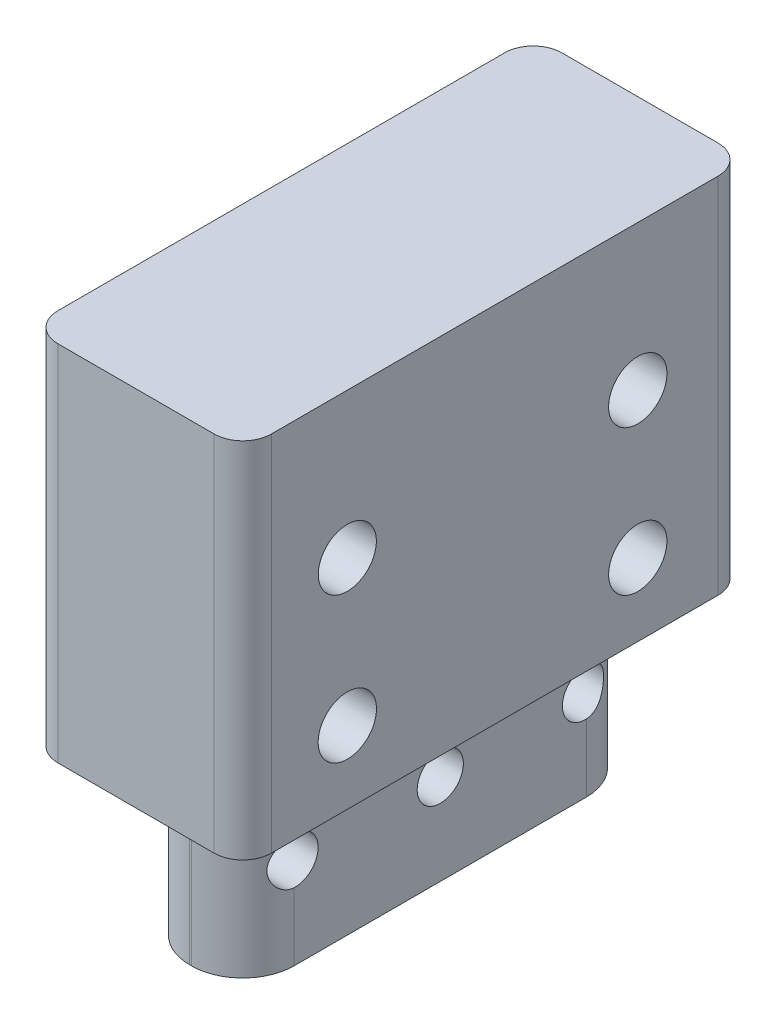
from build123d import *

# Parameters (mm, degrees)
SKETCH1_W           = 18.669
SKETCH1_H           = 50.8
BOSS_EXTRUDE1_DEPTH = 44.069
SKETCH2_W           = 44.069
SKETCH2_H           = 4.7625
CUT_EXTRUDE1_DEPTH  = 70.794328724
SKETCH3_W           = 44.069
SKETCH3_H           = 14.29004
CUT_EXTRUDE2_DEPTH  = 4.7625
SKETCH5_W           = 44.069
SKETCH5_H           = 14.29004
CUT_EXTRUDE3_DEPTH  = 4.7625
SKETCH4_W           = 18.669
SKETCH4_H           = 14.29004
CUT_EXTRUDE4_DEPTH  = 4.7625
SKETCH6_W           = 18.669
SKETCH6_H           = 14.29004
CUT_EXTRUDE5_DEPTH  = 4.7625
FILLET1_R           = 4.50088
FILLET2_R           = 2.49936
SKETCH7_R           = 2.5527
SKETCH7_R_2         = 2.54
CUT_EXTRUDE6_DEPTH  = 70.794328724
SKETCH8_R           = 2.0193
CUT_EXTRUDE7_DEPTH  = 69.673921566


with BuildPart() as part:
    # Sketch1 → Boss-Extrude1 (new body)
    with BuildSketch(Plane.XY):
        with Locations((9.3345, 25.4)):
            Rectangle(SKETCH1_W, SKETCH1_H)
    extrude(amount=BOSS_EXTRUDE1_DEPTH)

    # Sketch2 → Cut-Extrude1 (cut, through all)
    with BuildSketch(Plane(origin=(18.669, 0, 0), x_dir=(0, 0, -1), z_dir=(1, 0, 0))):
        with Locations((-22.0345, 2.38125)):
            Rectangle(SKETCH2_W, SKETCH2_H)
    extrude(amount=-CUT_EXTRUDE1_DEPTH, mode=Mode.SUBTRACT)

    # Sketch3 → Cut-Extrude2 (cut)
    with BuildSketch(Plane(origin=(18.669, 0, 0), x_dir=(0, 0, -1), z_dir=(1, 0, 0))):
        with Locations((-22.0345, 11.90752)):
            Rectangle(SKETCH3_W, SKETCH3_H)
    extrude(amount=-CUT_EXTRUDE2_DEPTH, mode=Mode.SUBTRACT)

    # Sketch5 → Cut-Extrude3 (cut)
    with BuildSketch(Plane.ZY):
        with Locations((22.0345, 11.90752)):
            Rectangle(SKETCH5_W, SKETCH5_H)
    extrude(amount=-CUT_EXTRUDE3_DEPTH, mode=Mode.SUBTRACT)

    # Sketch4 → Cut-Extrude4 (cut)
    with BuildSketch(Plane.XY.offset(44.069)):
        with Locations((9.3345, 11.90752)):
            Rectangle(SKETCH4_W, SKETCH4_H)
    extrude(amount=-CUT_EXTRUDE4_DEPTH, mode=Mode.SUBTRACT)

    # Sketch6 → Cut-Extrude5 (cut)
    with BuildSketch(Plane(origin=(0, 0, 0), x_dir=(-1, 0, 0), z_dir=(0, 0, -1))):
        with Locations((-9.3345, 11.90752)):
            Rectangle(SKETCH6_W, SKETCH6_H)
    extrude(amount=-CUT_EXTRUDE5_DEPTH, mode=Mode.SUBTRACT)

    # Fillet1
    fillet1_edges = [part.edges().sort_by_distance(p)[0] for p in [
        (4.7625, 11.90752, 39.3065),
        (13.9065, 11.90752, 39.3065),
        (4.7625, 11.90752, 4.7625),
        (13.9065, 11.90752, 4.7625),
    ]]
    fillet(fillet1_edges, radius=FILLET1_R)

    # Fillet2
    fillet2_edges = [part.edges().sort_by_distance(p)[0] for p in [
        (18.669, 34.92627, 0),
        (18.669, 34.92627, 44.069),
        (0, 34.92627, 44.069),
        (0, 34.92627, 0),
    ]]
    fillet(fillet2_edges, radius=FILLET2_R)

    # Sketch7 → Cut-Extrude6 (cut, through all)
    with BuildSketch(Plane.ZY):
        with Locations((9.52588, 38.1)):
            Circle(SKETCH7_R)
        with Locations((34.92588, 38.1)):
            Circle(SKETCH7_R_2)
        with Locations((34.92588, 25.4)):
            Circle(SKETCH7_R)
        with Locations((9.52588, 25.4)):
            Circle(SKETCH7_R)
    extrude(amount=-CUT_EXTRUDE6_DEPTH, mode=Mode.SUBTRACT)

    # Sketch8 → Cut-Extrude7 (cut, through all)
    with BuildSketch(Plane.ZY.offset(-4.7625)):
        with Locations((22.03538, 12.7)):
            Circle(SKETCH8_R)
        with Locations(Location((34.73538, 12.7, 0), (0, 0, 88.006602506))):
            Circle(SKETCH8_R)
        with Locations(Location((9.33538, 12.7, 0), (0, 0, 92.043366879))):
            Circle(SKETCH8_R)
    extrude(amount=-CUT_EXTRUDE7_DEPTH, mode=Mode.SUBTRACT)


solid = part.part
